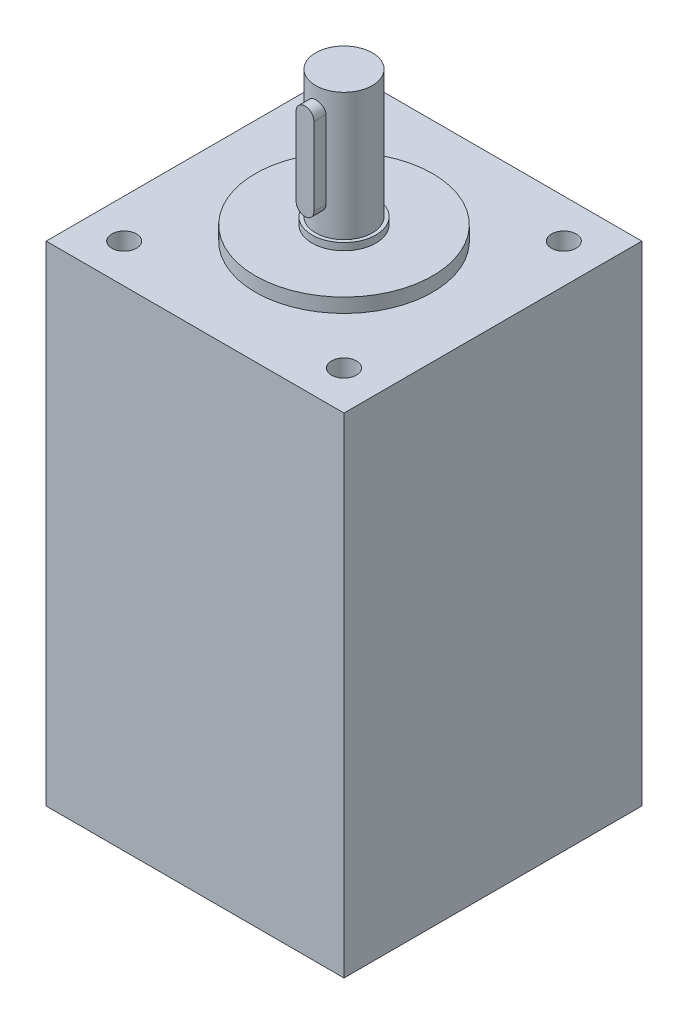
from build123d import *

# Parameters (mm, degrees)
SKETCH_2_W           = 42
SKETCH_2_H           = 42
EXTRUDE_1_DEPTH      = 69
SKETCH_3_R           = 12.5
EXTRUDE_2_DEPTH      = 2
SKETCH_4_R           = 4.5
EXTRUDE_3_DEPTH      = 1
SKETCH_5_R           = 4
EXTRUDE_4_DEPTH      = 18
EXTRUDE_5_DEPTH      = 1.5
EXTRUDE_5_DEPTH_BACK = 4
SKETCH_7_R           = 1.75
CUT_EXTRUDE_1_DEPTH  = 71.5


with BuildPart() as part:
    # 草图2 → 凸台-拉伸1 (new body)
    with BuildSketch(Plane(origin=(0, 0, 0), x_dir=(1, 0, 0), z_dir=(0, 1, 0))):
        with Locations((21, 21)):
            Rectangle(SKETCH_2_W, SKETCH_2_H)
    extrude(amount=EXTRUDE_1_DEPTH)

    # 草图3 → 凸台-拉伸2 (add)
    with BuildSketch(Plane(origin=(0, 69, 0), x_dir=(1, 0, 0), z_dir=(0, 1, 0))):
        with Locations(Location((21, 21, 0), (0, 0, 270))):
            Circle(SKETCH_3_R)
    extrude(amount=EXTRUDE_2_DEPTH)

    # 草图4 → 凸台-拉伸3 (add)
    with BuildSketch(Plane(origin=(0, 71, 0), x_dir=(1, 0, 0), z_dir=(0, 1, 0))):
        with Locations(Location((21, 21, 0), (0, 0, 270))):
            Circle(SKETCH_4_R)
    extrude(amount=EXTRUDE_3_DEPTH)

    # 草图5 → 凸台-拉伸4 (add)
    with BuildSketch(Plane(origin=(0, 72, 0), x_dir=(1, 0, 0), z_dir=(0, 1, 0))):
        with Locations(Location((21, 21, 0), (0, 0, 270))):
            Circle(SKETCH_5_R)
    extrude(amount=EXTRUDE_4_DEPTH)

    # 草图6 → 凸台-拉伸5 (add, two sides: drawn at the far end of the back side and taken through both)
    with BuildSketch(Plane.XY.offset(-17).offset(-EXTRUDE_5_DEPTH_BACK)):
        with BuildLine():
            Line((22.254851431, 87), (22.254851431, 76))
            ThreePointArc((22.254851431, 76), (21, 74.745148569), (19.745148569, 76))
            Line((19.745148569, 76), (19.745148569, 87))
            ThreePointArc((19.745148569, 87), (21, 88.254851431), (22.254851431, 87))
        make_face()
    extrude(amount=EXTRUDE_5_DEPTH + EXTRUDE_5_DEPTH_BACK)

    # 草图7 → 切除-拉伸1 (cut)
    with BuildSketch(Plane(origin=(0, 69, 0), x_dir=(1, 0, 0), z_dir=(0, 1, 0))):
        with Locations(Location((5.5, 36.5, 0), (0, 0, 270))):
            Circle(SKETCH_7_R)
        with Locations(Location((36.5, 36.5, 0), (0, 0, 90))):
            Circle(SKETCH_7_R)
        with Locations(Location((36.5, 5.5, 0), (0, 0, 270))):
            Circle(SKETCH_7_R)
        with Locations(Location((5.5, 5.5, 0), (0, 0, 90))):
            Circle(SKETCH_7_R)
    extrude(amount=-CUT_EXTRUDE_1_DEPTH, mode=Mode.SUBTRACT)


solid = part.part
